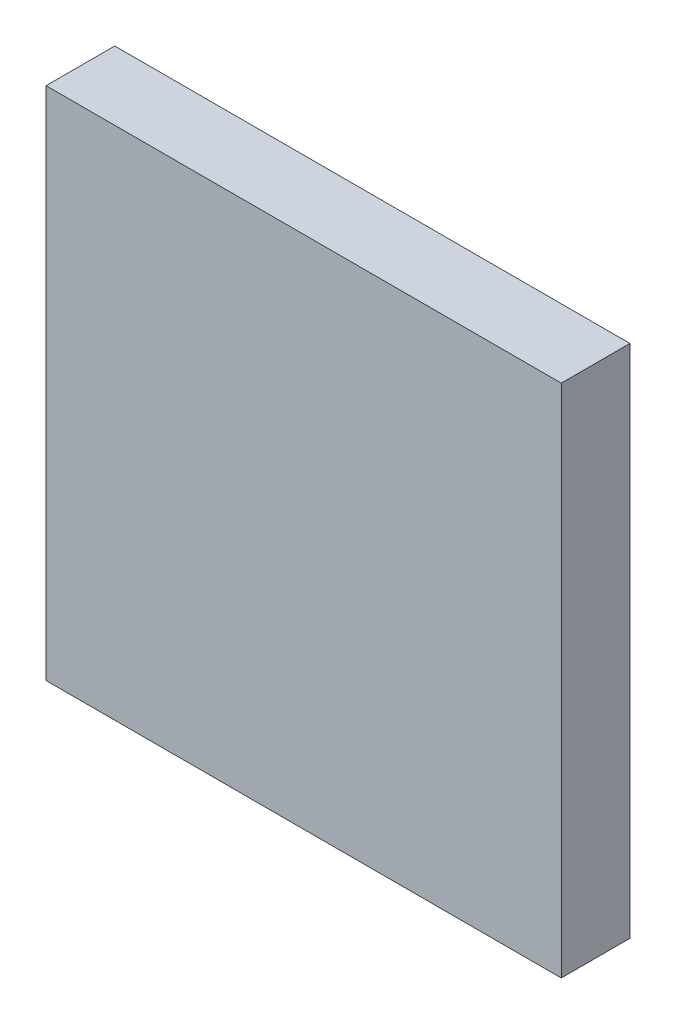
from build123d import *

# Parameters (mm, degrees)
SKETCH16_W          = 150
SKETCH16_H          = 150
BOSS_EXTRUDE6_DEPTH = 20


with BuildPart() as part:
    # Sketch16 → Boss-Extrude6 (new body)
    with BuildSketch(Plane.XY.offset(150)):
        with Locations((0, -75)):
            Rectangle(SKETCH16_W, SKETCH16_H)
    extrude(amount=BOSS_EXTRUDE6_DEPTH)


solid = part.part
